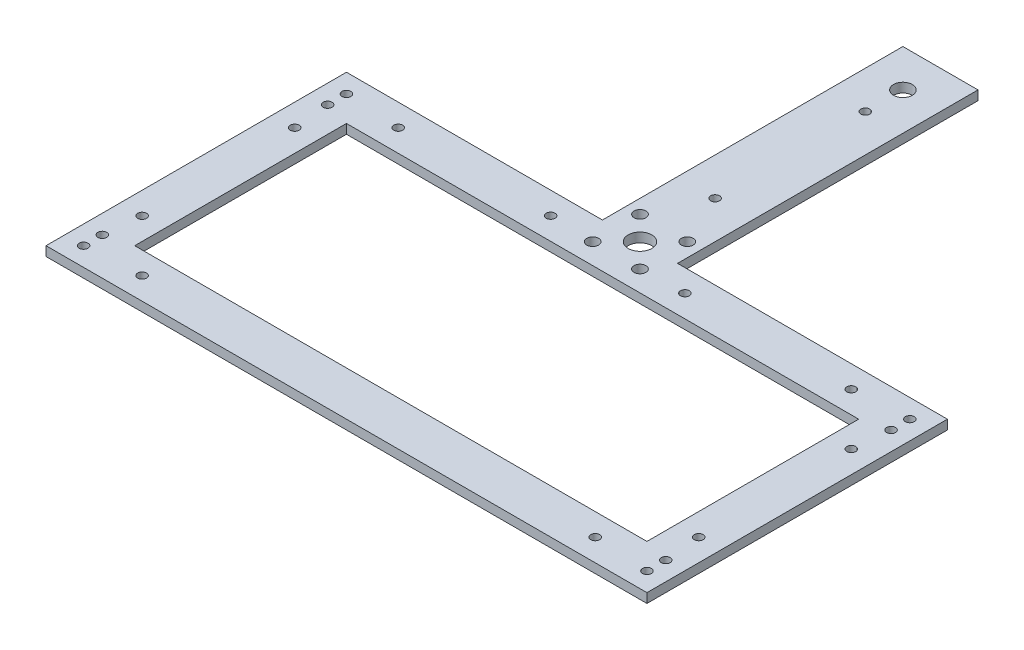
from build123d import *

# Parameters (mm, degrees)
SKETCH1_W           = 203.2
SKETCH1_H           = 101.6
SKETCH1_R           = 1.5
SKETCH1_W_2         = 173.2
SKETCH1_H_2         = 71.6
SKETCH1_W_3         = 25.4
BOSS_EXTRUDE1_DEPTH = 3.175
SKETCH2_R           = 2
SKETCH2_R_2         = 4
CUT_EXTRUDE1_DEPTH  = 3.175
SKETCH3_R           = 1.5
CUT_EXTRUDE2_DEPTH  = 10
SKETCH4_R           = 3.175
CUT_EXTRUDE3_DEPTH  = 10
SKETCH5_R           = 1.5
CUT_EXTRUDE4_DEPTH  = 10


with BuildPart() as part:
    # Sketch1 → Boss-Extrude1 (new body)
    # profile 1 of 2: a face of its own
    with BuildSketch(Plane(origin=(0, 0, 0), x_dir=(1, 0, 0), z_dir=(0, 1, 0))):
        with Locations((101.6, 50.8)):
            Rectangle(SKETCH1_W, SKETCH1_H)
        with Locations(Location((6.35, 95.25, 0), (0, 0, 270))):
            Circle(SKETCH1_R, mode=Mode.SUBTRACT)
        with Locations(Location((6.35, 88.9, 0), (0, 0, 270))):
            Circle(SKETCH1_R, mode=Mode.SUBTRACT)
        with Locations(Location((6.35, 6.35, 0), (0, 0, 270))):
            Circle(SKETCH1_R, mode=Mode.SUBTRACT)
        with Locations(Location((6.35, 12.7, 0), (0, 0, 270))):
            Circle(SKETCH1_R, mode=Mode.SUBTRACT)
        with Locations(Location((196.85, 95.25, 0), (0, 0, 270))):
            Circle(SKETCH1_R, mode=Mode.SUBTRACT)
        with Locations(Location((196.85, 88.9, 0), (0, 0, 270))):
            Circle(SKETCH1_R, mode=Mode.SUBTRACT)
        with Locations(Location((196.85, 12.7, 0), (0, 0, 270))):
            Circle(SKETCH1_R, mode=Mode.SUBTRACT)
        with Locations(Location((196.85, 6.35, 0), (0, 0, 270))):
            Circle(SKETCH1_R, mode=Mode.SUBTRACT)
        with Locations((101.6, 50.8)):
            Rectangle(SKETCH1_W_2, SKETCH1_H_2, mode=Mode.SUBTRACT)
    # profile 2 of 2: a face of its own
    with BuildSketch(Plane(origin=(0, 0, 0), x_dir=(1, 0, 0), z_dir=(0, 1, 0))):
        with Locations((99.246196593, 152.4)):
            Rectangle(SKETCH1_W_3, SKETCH1_H)
    extrude(amount=BOSS_EXTRUDE1_DEPTH)

    # Sketch2 → Cut-Extrude1 (cut)
    with BuildSketch(Plane(origin=(0, 3.175, 0), x_dir=(1, 0, 0), z_dir=(0, 1, 0))):
        with Locations(Location((91.246196593, 109.6, 0), (0, 0, 270))):
            Circle(SKETCH2_R)
        with Locations(Location((107.246196593, 109.6, 0), (0, 0, 270))):
            Circle(SKETCH2_R)
        with Locations(Location((91.246196593, 93.6, 0), (0, 0, 270))):
            Circle(SKETCH2_R)
        with Locations(Location((107.246196593, 93.6, 0), (0, 0, 270))):
            Circle(SKETCH2_R)
        with Locations(Location((99.246196593, 101.6, 0), (0, 0, 270))):
            Circle(SKETCH2_R_2)
    extrude(amount=-CUT_EXTRUDE1_DEPTH, mode=Mode.SUBTRACT)

    # Sketch3 → Cut-Extrude2 (cut)
    with BuildSketch(Plane(origin=(0, 3.175, 0), x_dir=(1, 0, 0), z_dir=(0, 1, 0))):
        with Locations(Location((178.2, 94.1, 0), (0, 0, 270))):
            Circle(SKETCH3_R)
        with Locations(Location((25, 94.1, 0), (0, 0, 270))):
            Circle(SKETCH3_R)
        with Locations(Location((76.546196593, 94.1, 0), (0, 0, 270))):
            Circle(SKETCH3_R)
        with Locations(Location((121.946196593, 94.1, 0), (0, 0, 270))):
            Circle(SKETCH3_R)
        with Locations(Location((178.2, 7.5, 0), (0, 0, 270))):
            Circle(SKETCH3_R)
        with Locations(Location((25, 7.5, 0), (0, 0, 270))):
            Circle(SKETCH3_R)
        with Locations(Location((195.7, 76.6, 0), (0, 0, 270))):
            Circle(SKETCH3_R)
        with Locations(Location((195.7, 25, 0), (0, 0, 270))):
            Circle(SKETCH3_R)
        with Locations(Location((7.5, 76.6, 0), (0, 0, 270))):
            Circle(SKETCH3_R)
        with Locations(Location((7.5, 25, 0), (0, 0, 270))):
            Circle(SKETCH3_R)
    extrude(amount=-CUT_EXTRUDE2_DEPTH, mode=Mode.SUBTRACT)

    # Sketch4 → Cut-Extrude3 (cut)
    with BuildSketch(Plane(origin=(0, 3.175, 0), x_dir=(1, 0, 0), z_dir=(0, 1, 0))):
        with Locations(Location((99.246196593, 190.5, 0), (0, 0, 270))):
            Circle(SKETCH4_R)
    extrude(amount=-CUT_EXTRUDE3_DEPTH, mode=Mode.SUBTRACT)

    # Sketch5 → Cut-Extrude4 (cut)
    with BuildSketch(Plane(origin=(0, 3.175, 0), x_dir=(1, 0, 0), z_dir=(0, 1, 0))):
        with Locations(Location((99.246196593, 177.8, 0), (0, 0, 270))):
            Circle(SKETCH5_R)
        with Locations(Location((99.246196593, 127, 0), (0, 0, 270))):
            Circle(SKETCH5_R)
    extrude(amount=-CUT_EXTRUDE4_DEPTH, mode=Mode.SUBTRACT)


solid = part.part
